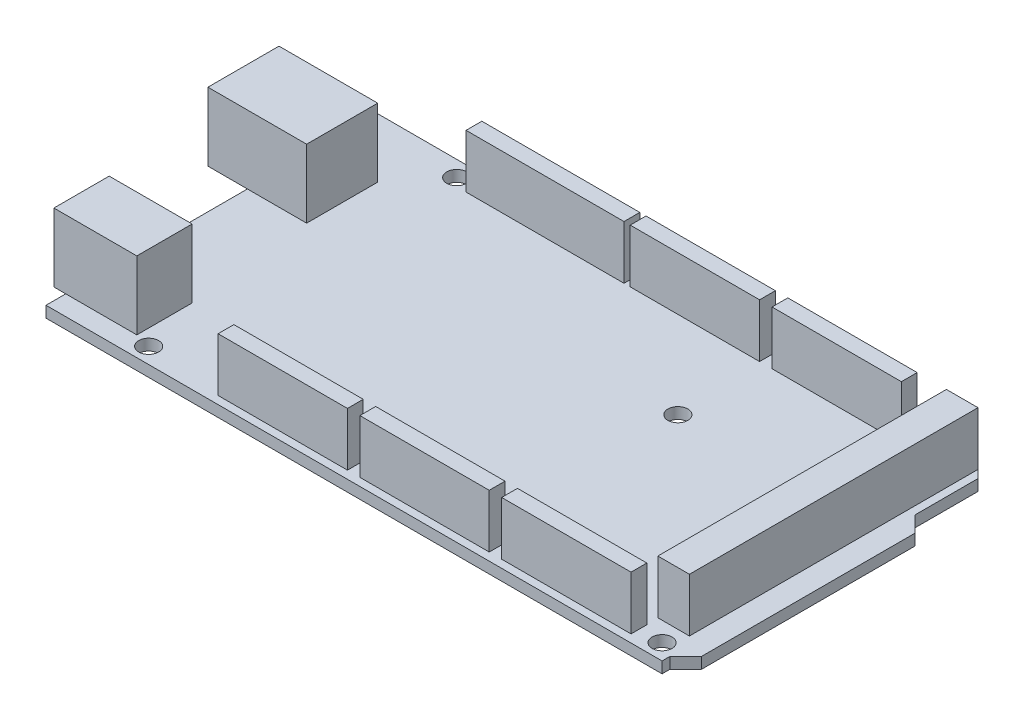
from build123d import *

# Parameters (mm, degrees)
BOSS_EXTRUDE1_DEPTH = 1.8
CUT_EXTRUDE1_REACH  = 60.53
SKETCH2_R           = 1.6
SKETCH3_W           = 15.875
SKETCH3_H           = 11.43
BOSS_EXTRUDE2_DEPTH = 11
SKETCH4_W           = 13.335
SKETCH4_H           = 8.89
BOSS_EXTRUDE3_DEPTH = 11
SKETCH5_W           = 20.8
SKETCH5_H           = 2.54
SKETCH5_W_2         = 5.08
SKETCH5_H_2         = 46.4
SKETCH5_W_3         = 25.4
BOSS_EXTRUDE4_DEPTH = 8.6


with BuildPart() as part:
    # Sketch1 → Boss-Extrude1 (new body)
    with BuildSketch(Plane(origin=(0, 0, 0), x_dir=(1, 0, 0), z_dir=(0, 1, 0))):
        Polygon((-49.53, -26.67), (49.53, -26.67), (49.53, -25.4), (52.07, -22.86), (52.07, 11.43), (49.53, 13.97), (49.53, 24.13), (46.99, 26.67), (-49.53, 26.67), align=None)
    extrude(amount=BOSS_EXTRUDE1_DEPTH)

    # Sketch2 → Cut-Extrude1 (cut, up to next)
    with BuildSketch(Plane(origin=(0, 1.8, 0), x_dir=(1, 0, 0), z_dir=(0, 1, 0)), mode=Mode.PRIVATE) as cut_extrude1_sk1:
        with Locations(Location((-35.56, -24.13, 0), (0, 0, 270))):
            Circle(SKETCH2_R)
    cut_extrude1_tool1 = extrude(cut_extrude1_sk1.sketch, amount=-CUT_EXTRUDE1_REACH, mode=Mode.PRIVATE) & part.part
    # Sketch2 → Cut-Extrude1 (cut, up to next)
    with BuildSketch(Plane(origin=(0, 1.8, 0), x_dir=(1, 0, 0), z_dir=(0, 1, 0)), mode=Mode.PRIVATE) as cut_extrude1_sk2:
        with Locations(Location((16.51, -19.05, 0), (0, 0, 270))):
            Circle(SKETCH2_R)
    cut_extrude1_tool2 = extrude(cut_extrude1_sk2.sketch, amount=-CUT_EXTRUDE1_REACH, mode=Mode.PRIVATE) & part.part
    # Sketch2 → Cut-Extrude1 (cut, up to next)
    with BuildSketch(Plane(origin=(0, 1.8, 0), x_dir=(1, 0, 0), z_dir=(0, 1, 0)), mode=Mode.PRIVATE) as cut_extrude1_sk3:
        with Locations(Location((16.51, 8.89, 0), (0, 0, 270))):
            Circle(SKETCH2_R)
    cut_extrude1_tool3 = extrude(cut_extrude1_sk3.sketch, amount=-CUT_EXTRUDE1_REACH, mode=Mode.PRIVATE) & part.part
    # Sketch2 → Cut-Extrude1 (cut, up to next)
    with BuildSketch(Plane(origin=(0, 1.8, 0), x_dir=(1, 0, 0), z_dir=(0, 1, 0)), mode=Mode.PRIVATE) as cut_extrude1_sk4:
        with Locations(Location((46.99, -24.13, 0), (0, 0, 270))):
            Circle(SKETCH2_R)
    cut_extrude1_tool4 = extrude(cut_extrude1_sk4.sketch, amount=-CUT_EXTRUDE1_REACH, mode=Mode.PRIVATE) & part.part
    # Sketch2 → Cut-Extrude1 (cut, up to next)
    with BuildSketch(Plane(origin=(0, 1.8, 0), x_dir=(1, 0, 0), z_dir=(0, 1, 0)), mode=Mode.PRIVATE) as cut_extrude1_sk5:
        with Locations(Location((40.64, 24.13, 0), (0, 0, 270))):
            Circle(SKETCH2_R)
    cut_extrude1_tool5 = extrude(cut_extrude1_sk5.sketch, amount=-CUT_EXTRUDE1_REACH, mode=Mode.PRIVATE) & part.part
    # Sketch2 → Cut-Extrude1 (cut, up to next)
    with BuildSketch(Plane(origin=(0, 1.8, 0), x_dir=(1, 0, 0), z_dir=(0, 1, 0)), mode=Mode.PRIVATE) as cut_extrude1_sk6:
        with Locations(Location((-34.29, 24.13, 0), (0, 0, 270))):
            Circle(SKETCH2_R)
    cut_extrude1_tool6 = extrude(cut_extrude1_sk6.sketch, amount=-CUT_EXTRUDE1_REACH, mode=Mode.PRIVATE) & part.part
    add(cut_extrude1_tool1.solids().sort_by_distance((-35.56, 1.8, 24.13))[0], mode=Mode.SUBTRACT)
    add(cut_extrude1_tool2.solids().sort_by_distance((16.51, 1.8, 19.05))[0], mode=Mode.SUBTRACT)
    add(cut_extrude1_tool3.solids().sort_by_distance((16.51, 1.8, -8.89))[0], mode=Mode.SUBTRACT)
    add(cut_extrude1_tool4.solids().sort_by_distance((46.99, 1.8, 24.13))[0], mode=Mode.SUBTRACT)
    add(cut_extrude1_tool5.solids().sort_by_distance((40.64, 1.8, -24.13))[0], mode=Mode.SUBTRACT)
    add(cut_extrude1_tool6.solids().sort_by_distance((-34.29, 1.8, -24.13))[0], mode=Mode.SUBTRACT)

    # Sketch3 → Boss-Extrude2 (add)
    with BuildSketch(Plane(origin=(0, 1.8, 0), x_dir=(1, 0, 0), z_dir=(0, 1, 0))):
        with Locations((-47.9425, 11.43)):
            Rectangle(SKETCH3_W, SKETCH3_H)
    extrude(amount=BOSS_EXTRUDE2_DEPTH)

    # Sketch4 → Boss-Extrude3 (add)
    with BuildSketch(Plane(origin=(0, 1.8, 0), x_dir=(1, 0, 0), z_dir=(0, 1, 0))):
        with Locations((-44.7675, -19.05)):
            Rectangle(SKETCH4_W, SKETCH4_H)
    extrude(amount=BOSS_EXTRUDE3_DEPTH)

    # Sketch5 → Boss-Extrude4 (add)
    with BuildSketch(Plane(origin=(0, 1.8, 0), x_dir=(1, 0, 0), z_dir=(0, 1, 0))):
        with Locations((-12.73, -24.13)):
            Rectangle(SKETCH5_W, SKETCH5_H)
        with Locations((10.07, -24.13)):
            Rectangle(SKETCH5_W, SKETCH5_H)
        with Locations((32.87, -24.13)):
            Rectangle(SKETCH5_W, SKETCH5_H)
        with Locations((45.72, 2.2)):
            Rectangle(SKETCH5_W_2, SKETCH5_H_2)
        with Locations((28.08, 24.13)):
            Rectangle(SKETCH5_W, SKETCH5_H)
        with Locations((5.28, 24.13)):
            Rectangle(SKETCH5_W, SKETCH5_H)
        with Locations((-18.82, 24.13)):
            Rectangle(SKETCH5_W_3, SKETCH5_H)
    extrude(amount=BOSS_EXTRUDE4_DEPTH)


solid = part.part
